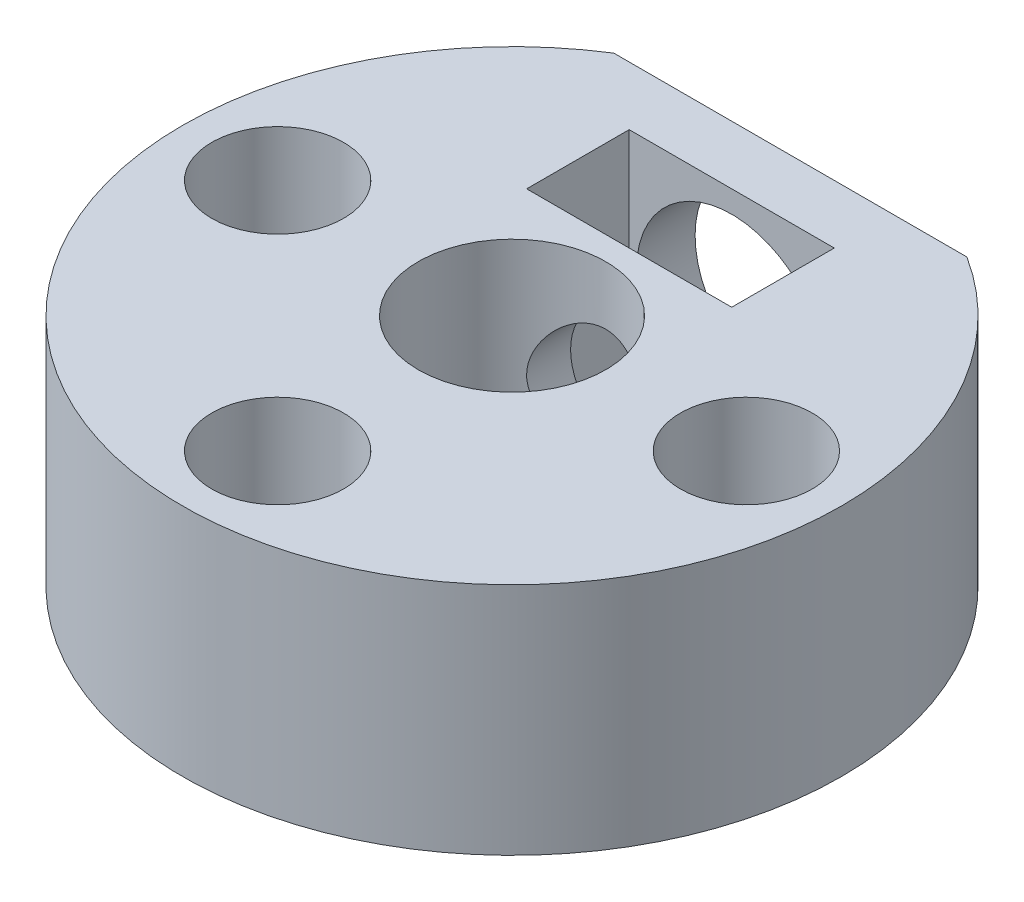
from build123d import *

# Parameters (mm, degrees)
BOSS_EXTRU_1_DEPTH                              = 8
SKETCH1_R                                       = 3.2
CUT_EXTRUDE1_DEPTH                              = 18.808003819
ESQUISSE7_W                                     = 7
ESQUISSE7_H                                     = 3.5
ENL_V_MAT_EXTRU_2_DEPTH                         = 18.808003819
CHAMBRAGE_POUR_VIS_T_TE_CYLINDRIQUE_D           = 2.5
CHAMBRAGE_POUR_VIS_T_TE_CYLINDRIQUE_CBORE_D     = 4.5
CHAMBRAGE_POUR_VIS_T_TE_CYLINDRIQUE_CBORE_DEPTH = 5.3
CBORE_FOR_M5_HEX_HEAD_BOLT1_D                   = 4
CBORE_FOR_M5_HEX_HEAD_BOLT1_DEPTH               = 9.499
CBORE_FOR_M5_HEX_HEAD_BOLT1_CBORE_D             = 6.5
CBORE_FOR_M5_HEX_HEAD_BOLT1_CBORE_DEPTH         = 2
CBORE_FOR_M5_HEX_HEAD_BOLT1_TIP                 = 1.201721238


with BuildPart() as part:
    # Esquisse1 → Boss.-Extru.1 (new body)
    with BuildSketch(Plane(origin=(0, 0, 0), x_dir=(1, 0, 0), z_dir=(0, 1, 0))):
        with BuildLine():
            Line((6.025985397, 9.5), (-6.025985397, 9.5))
            ThreePointArc((-6.025985397, 9.5), (0, -11.25), (6.025985397, 9.5))
        make_face()
    extrude(amount=BOSS_EXTRU_1_DEPTH)

    # Sketch1 → Cut-Extrude1 (cut, through all)
    with BuildSketch(Plane(origin=(0, 8, 0), x_dir=(1, 0, 0), z_dir=(0, 1, 0))):
        with Locations(Location((0, 0, 0), (0, 0, 270))):
            Circle(SKETCH1_R)
    extrude(amount=-CUT_EXTRUDE1_DEPTH, mode=Mode.SUBTRACT)

    # Esquisse7 → Enlèv. mat.-Extru.2 (cut, through all)
    with BuildSketch(Plane(origin=(0, 8, 0), x_dir=(1, 0, 0), z_dir=(0, 1, 0))):
        with Locations((0, 5.75)):
            Rectangle(ESQUISSE7_W, ESQUISSE7_H)
    extrude(amount=-ENL_V_MAT_EXTRU_2_DEPTH, mode=Mode.SUBTRACT)

    # Chambrage pour vis à tête cylindrique à 6 pans creux (ou vis CHC) M21 (through all)
    with Locations(Plane(origin=(0, 8, 0), x_dir=(1, 0, 0), z_dir=(0, 1, 0))):
        with Locations((-8, 0), (0, -8), (8, 0)):
            CounterBoreHole(CHAMBRAGE_POUR_VIS_T_TE_CYLINDRIQUE_D / 2, CHAMBRAGE_POUR_VIS_T_TE_CYLINDRIQUE_CBORE_D / 2, CHAMBRAGE_POUR_VIS_T_TE_CYLINDRIQUE_CBORE_DEPTH)

    # CBORE for M5 Hex Head Bolt1
    with Locations(Plane(origin=(0, 0, -9.5), x_dir=(-1, 0, 0), z_dir=(0, 0, -1))):
        with Locations((0, 4)):
            CounterBoreHole(CBORE_FOR_M5_HEX_HEAD_BOLT1_D / 2, CBORE_FOR_M5_HEX_HEAD_BOLT1_CBORE_D / 2, CBORE_FOR_M5_HEX_HEAD_BOLT1_CBORE_DEPTH, depth=CBORE_FOR_M5_HEX_HEAD_BOLT1_DEPTH)
            with Locations((0, 0, -(CBORE_FOR_M5_HEX_HEAD_BOLT1_DEPTH + CBORE_FOR_M5_HEX_HEAD_BOLT1_TIP / 2))):  # 118° drill point
                Cone(0, CBORE_FOR_M5_HEX_HEAD_BOLT1_D / 2, CBORE_FOR_M5_HEX_HEAD_BOLT1_TIP, mode=Mode.SUBTRACT)


solid = part.part
